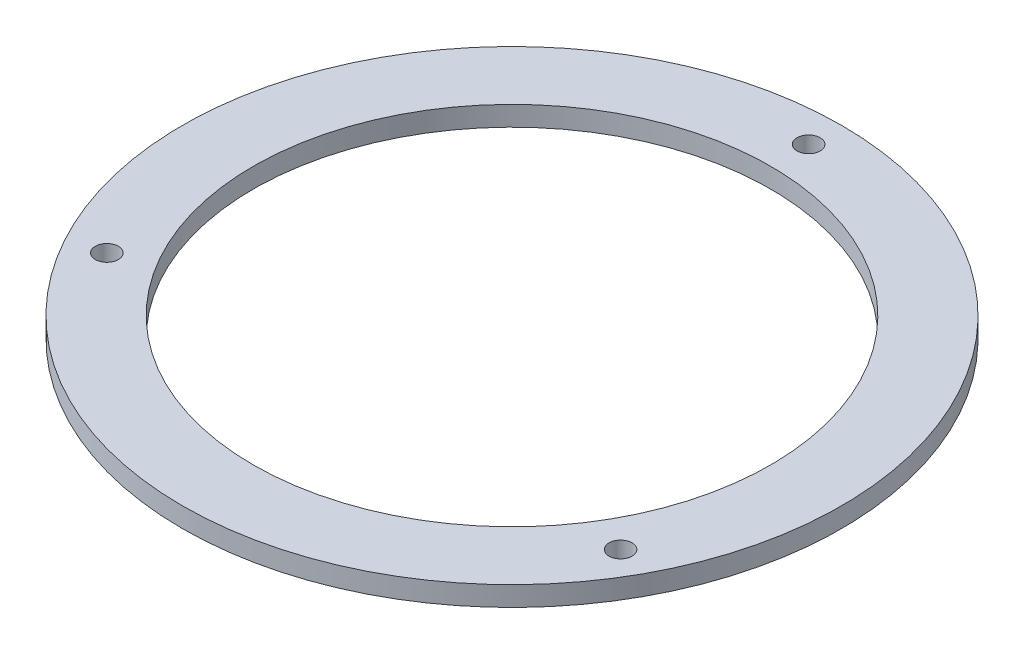
from build123d import *

# Parameters (mm, degrees)
SKETCH1_R           = 50
SKETCH1_R_2         = 39.25
SKETCH1_R_3         = 1.75
BOSS_EXTRUDE1_DEPTH = 3


with BuildPart() as part:
    # Sketch1 → Boss-Extrude1 (new body)
    with BuildSketch(Plane(origin=(0, 0, 0), x_dir=(1, 0, 0), z_dir=(0, 1, 0))):
        with Locations(Location((0, 0, 0), (0, 0, 270))):
            Circle(SKETCH1_R)
        with Locations(Location((0, 0, 0), (0, 0, 270))):
            Circle(SKETCH1_R_2, mode=Mode.SUBTRACT)
        with Locations(Location((0, 45, 0), (0, 0, 270))):
            Circle(SKETCH1_R_3, mode=Mode.SUBTRACT)
        with Locations(Location((38.97114317, -22.5, 0), (0, 0, 270))):
            Circle(SKETCH1_R_3, mode=Mode.SUBTRACT)
        with Locations(Location((-38.97114317, -22.5, 0), (0, 0, 270))):
            Circle(SKETCH1_R_3, mode=Mode.SUBTRACT)
    extrude(amount=BOSS_EXTRUDE1_DEPTH)


solid = part.part
